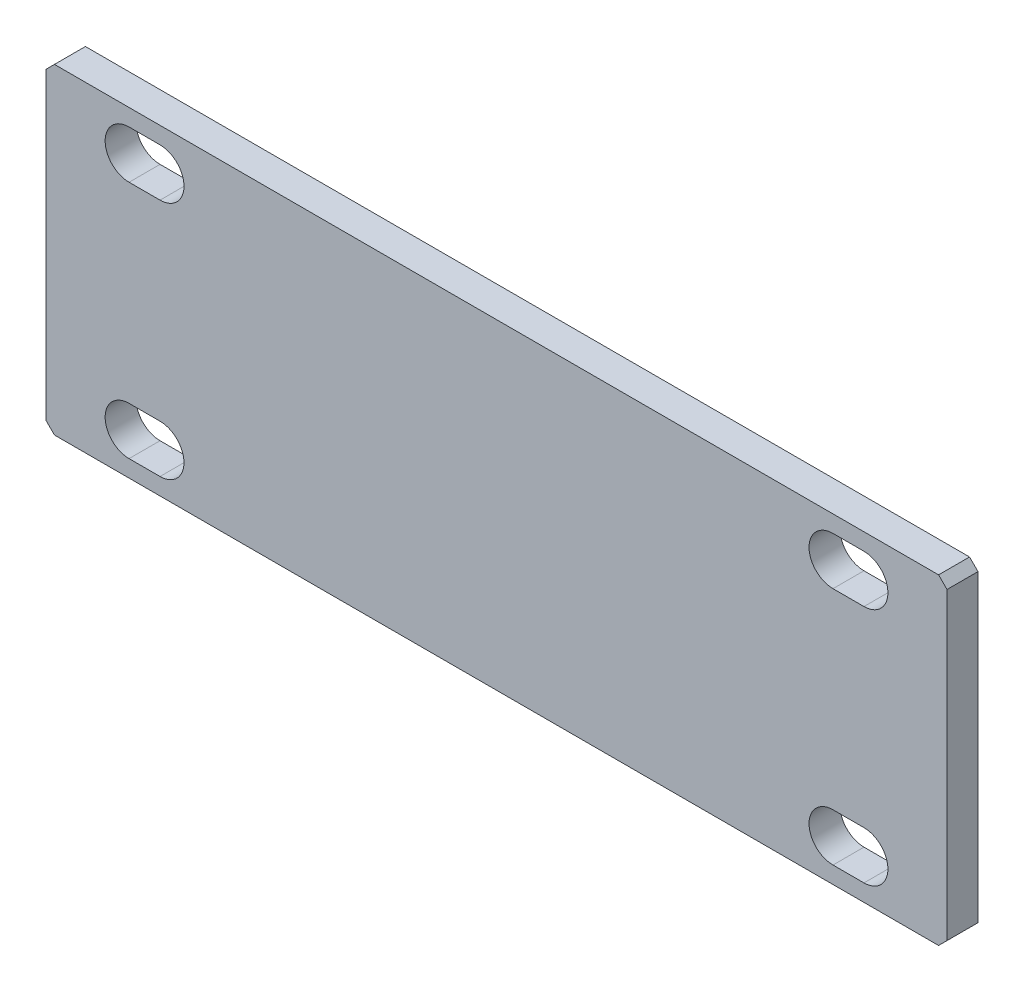
from build123d import *

# Parameters (mm, degrees)
FOUR_3_4_MM_POWER_PCB_SLOTS_NOMINAL_PA_DEPTH = 2.2


with BuildPart() as part:
    # Four 3.4 mm power PCB slots - nomina 2 → Four 3.4 mm power PCB slots - nominal pa (new body)
    with BuildSketch(Plane.XY):
        Polygon((-31.4, -11.4), (31.4, -11.4), (32, -10.8), (32, 10.8), (31.4, 11.4), (-31.4, 11.4), (-32, 10.8), (-32, -10.8), align=None)
        with BuildLine():
            Line((-26.1, -10.2), (-23.9, -10.2))
            ThreePointArc((-23.9, -10.2), (-22.2, -8.5), (-23.9, -6.8))
            Line((-23.9, -6.8), (-26.1, -6.8))
            ThreePointArc((-26.1, -6.8), (-27.8, -8.5), (-26.1, -10.2))
        make_face(mode=Mode.SUBTRACT)
        with BuildLine():
            Line((-26.1, 6.8), (-23.9, 6.8))
            ThreePointArc((-23.9, 6.8), (-22.2, 8.5), (-23.9, 10.2))
            Line((-23.9, 10.2), (-26.1, 10.2))
            ThreePointArc((-26.1, 10.2), (-27.8, 8.5), (-26.1, 6.8))
        make_face(mode=Mode.SUBTRACT)
        with BuildLine():
            Line((23.9, -10.2), (26.1, -10.2))
            ThreePointArc((26.1, -10.2), (27.8, -8.5), (26.1, -6.8))
            Line((26.1, -6.8), (23.9, -6.8))
            ThreePointArc((23.9, -6.8), (22.2, -8.5), (23.9, -10.2))
        make_face(mode=Mode.SUBTRACT)
        with BuildLine():
            Line((23.9, 6.8), (26.1, 6.8))
            ThreePointArc((26.1, 6.8), (27.8, 8.5), (26.1, 10.2))
            Line((26.1, 10.2), (23.9, 10.2))
            ThreePointArc((23.9, 10.2), (22.2, 8.5), (23.9, 6.8))
        make_face(mode=Mode.SUBTRACT)
    extrude(amount=FOUR_3_4_MM_POWER_PCB_SLOTS_NOMINAL_PA_DEPTH)


solid = part.part
